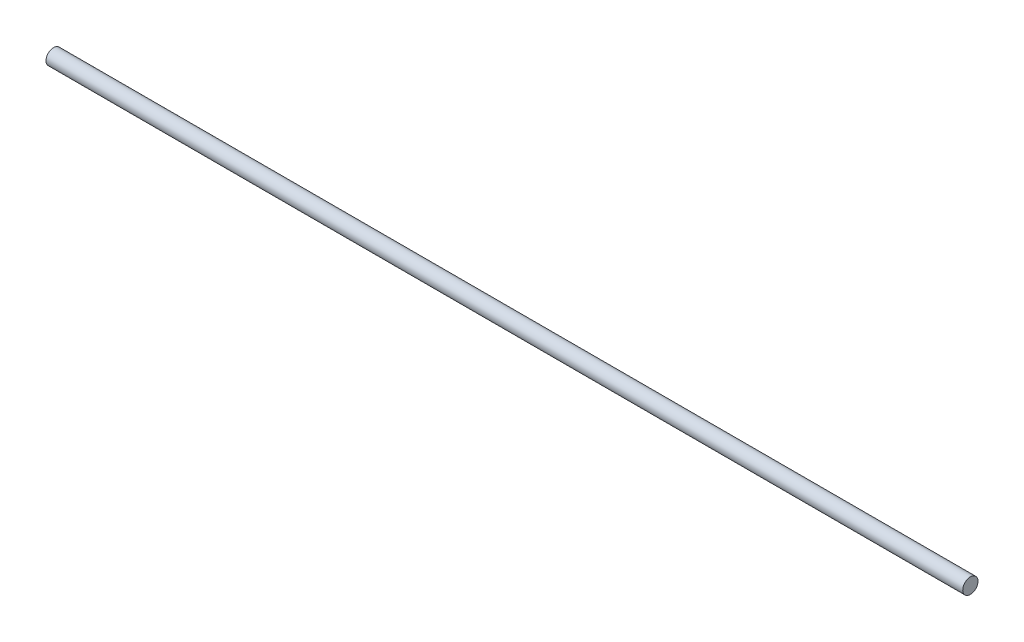
from build123d import *

# Parameters (mm, degrees)
SKETCH2_R           = 1.5
BOSS_EXTRUDE1_DEPTH = 180


with BuildPart() as part:
    # Sketch2 → Boss-Extrude1 (new body)
    with BuildSketch(Plane(origin=(0, 0, 0), x_dir=(0, 0, -1), z_dir=(1, 0, 0))):
        with Locations(Location((0, 0, 0), (0, 0, 180))):
            Circle(SKETCH2_R)
    extrude(amount=BOSS_EXTRUDE1_DEPTH)


solid = part.part
